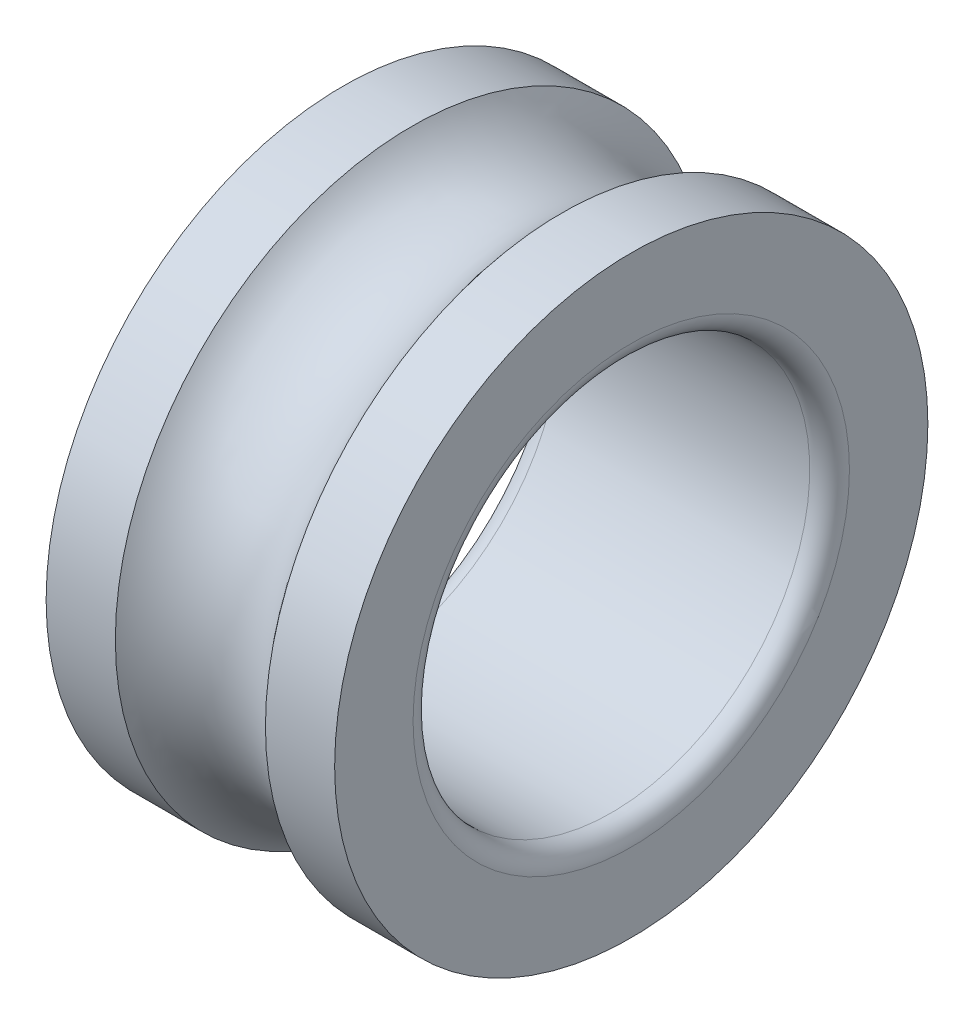
from build123d import *


with BuildPart() as part:
    # Sketch1 → Revolução1 (revolve)
    with BuildSketch(Plane.XY, mode=Mode.PRIVATE) as revolu_o1_sk:
        with BuildLine():
            Line((1.1, 11), (14.9, 11))
            ThreePointArc((14.9, 11), (15.677817459, 11.322182541), (16, 12.1))
            Line((16, 12.1), (16, 16.45))
            Line((16, 16.45), (12.161482939, 16.45))
            ThreePointArc((12.161482939, 16.45), (8, 14.3405), (3.838517061, 16.45))
            Line((3.838517061, 16.45), (0, 16.45))
            Line((0, 16.45), (0, 12.1))
            ThreePointArc((0, 12.1), (0.322182541, 11.322182541), (1.1, 11))
        make_face()
    revolve(revolu_o1_sk.sketch.rotate(Axis((50, 0, 0), (-1, 0, 0)), 270), axis=Axis((50, 0, 0), (-1, 0, 0)))


solid = part.part
